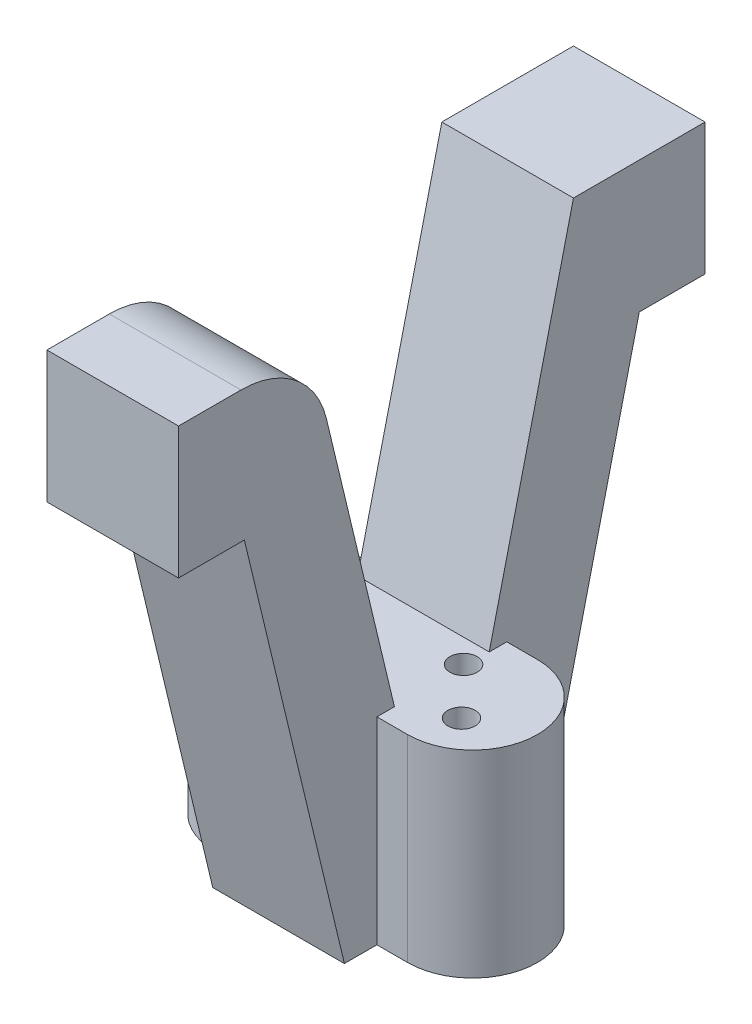
from build123d import *

# Parameters (mm, degrees)
BOSS_EXTRUDE2_DEPTH = 1.5
FILLET1_R           = 2
BOSS_EXTRUDE3_DEPTH = 4.5
SKETCH1_3_R         = 0.63
SKETCH1_3_R_2       = 0.310429465
CUT_EXTRUDE2_DEPTH  = 15.345466183


with BuildPart() as part:
    # Sketch2 → Boss-Extrude2 (new, symmetric)
    with BuildSketch(Plane(origin=(0, 0, 0), x_dir=(0, 0, -1), z_dir=(1, 0, 0))):
        Polygon((-6, 12.5), (-6, 9.5), (-4.5, 9.5), (-2.22, 0), (0, 0), (-3, 12.5), align=None)
    boss_extrude2 = extrude(amount=BOSS_EXTRUDE2_DEPTH, both=True)

    # Fillet1
    fillet1_edges = [part.edges().sort_by_distance(p)[0] for p in [
        (0, 12.5, 3),
    ]]
    fillet(fillet1_edges, radius=FILLET1_R)

    # Sketch1 → Boss-Extrude3 (add)
    with BuildSketch(Plane(origin=(0, 0, 0), x_dir=(1, 0, 0), z_dir=(0, 1, 0))):
        with BuildLine():
            Line((-2.2, 1.48), (2.2, 1.48))
            ThreePointArc((2.2, 1.48), (3.68, 0), (2.2, -1.48))
            Line((2.2, -1.48), (-2.2, -1.48))
            ThreePointArc((-2.2, -1.48), (-3.68, 0), (-2.2, 1.48))
        make_face()
    extrude(amount=BOSS_EXTRUDE3_DEPTH)

    # Mirror1: Boss-Extrude2 across plane
    add(boss_extrude2.mirror(Plane.XY))

    # Sketch1<3> → Cut-Extrude2 (cut, through all)
    with BuildSketch(Plane(origin=(0, 0, 0), x_dir=(1, 0, 0), z_dir=(0, 1, 0))):
        with Locations((-1.210810654, 0)):
            Circle(SKETCH1_3_R)
        with Locations((1.453538454, 0.541981393)):
            Circle(SKETCH1_3_R_2)
        with Locations((2.490372423, -0.541981393)):
            Circle(SKETCH1_3_R_2)
    extrude(amount=CUT_EXTRUDE2_DEPTH, mode=Mode.SUBTRACT)


solid = part.part
